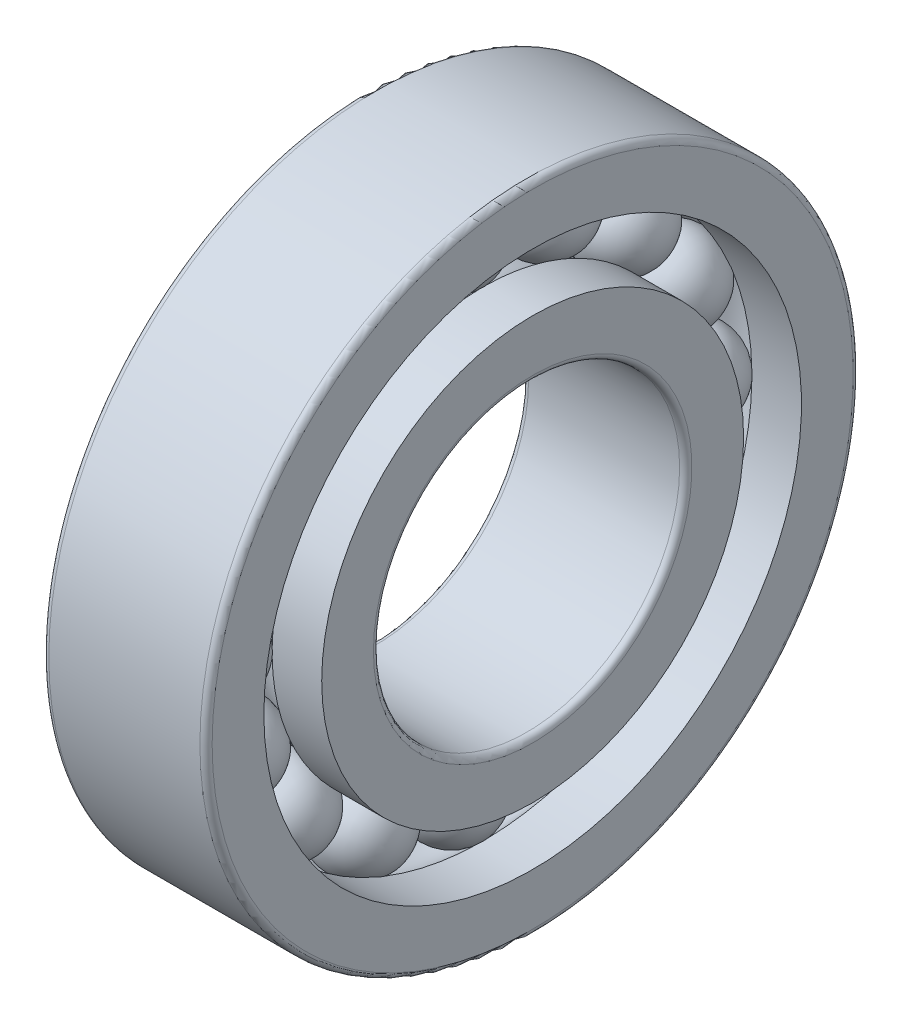
from build123d import *

# Parameters (mm, degrees)
CIRCULAR_PATTERN1_COUNT = 16
FILLET1_R               = 0.3


with BuildPart() as part:
    # Sketch1 → Revolve1 (revolve)
    with BuildSketch(Plane.XY):
        with BuildLine():
            Line((-2.125, 11.75), (2.125, 11.75))
            ThreePointArc((2.125, 11.75), (1.3e-16, 13.875), (-2.125, 11.75))
        make_face()
    revolve1 = revolve(axis=Axis((-4.596601835273904, 11.75, 0), (1, 0, 0)))

    # Sketch2 → Revolve2 (revolve)
    with BuildSketch(Plane.XY, mode=Mode.PRIVATE) as revolve2_sk:
        with BuildLine():
            Line((-4, 10.333333333333332), (-3.999999999999999, 7.5))
            Line((-3.999999999999999, 7.5), (4.000000000000001, 7.5))
            Line((4.000000000000001, 7.5), (4, 10.333333333333334))
            Line((4, 10.333333333333334), (1.5704396058287466, 10.333333333333332))
            ThreePointArc((1.5704396058287466, 10.333333333333332), (1.3e-16, 9.635000000000002), (-1.5704396058287466, 10.333333333333332))
            Line((-1.5704396058287466, 10.333333333333332), (-4, 10.333333333333332))
        make_face()
    revolve(revolve2_sk.sketch.rotate(Axis((-6.971390126215839, 0, 0), (1, 0, 0)), 90), axis=Axis((-6.971390126215839, 0, 0), (1, 0, 0)))

    # Sketch3 → Revolve3 (revolve)
    with BuildSketch(Plane.XY, mode=Mode.PRIVATE) as revolve3_sk:
        with BuildLine():
            Line((-3.999999999999999, 16), (4, 16))
            Line((4, 16), (4.000000000000001, 13.166666666666666))
            Line((4.000000000000001, 13.166666666666666), (1.5704396058287489, 13.166666666666666))
            ThreePointArc((1.5704396058287489, 13.166666666666666), (1.3e-16, 13.865), (-1.5704396058287489, 13.166666666666666))
            Line((-1.5704396058287489, 13.166666666666666), (-3.9999999999999982, 13.166666666666666))
            Line((-3.9999999999999982, 13.166666666666666), (-3.999999999999999, 16))
        make_face()
    revolve(revolve3_sk.sketch.rotate(Axis((-8.710676494715049, 0, 0), (1, 0, 0)), 90), axis=Axis((-8.710676494715049, 0, 0), (1, 0, 0)))

    # Circular-Pattern1: Revolve1 ×16 about axis
    circular_pattern1_axis = Axis((0, -1.3e-16, 2.1e-16), (1, 0, 0))
    for i in range(1, CIRCULAR_PATTERN1_COUNT):
        add(revolve1.rotate(circular_pattern1_axis, i * 360 / CIRCULAR_PATTERN1_COUNT))

    # Fillet1
    fillet1_edges = [part.edges().sort_by_distance(p)[0] for p in [
        (-3.999999999999999, -3.74e-15, -16),
        (4, -3.74e-15, -16),
        (-3.999999999999999, -5.08e-15, -7.5),
        (4.000000000000002, -5.08e-15, -7.5),
    ]]
    fillet(fillet1_edges, radius=FILLET1_R)


solid = part.part
